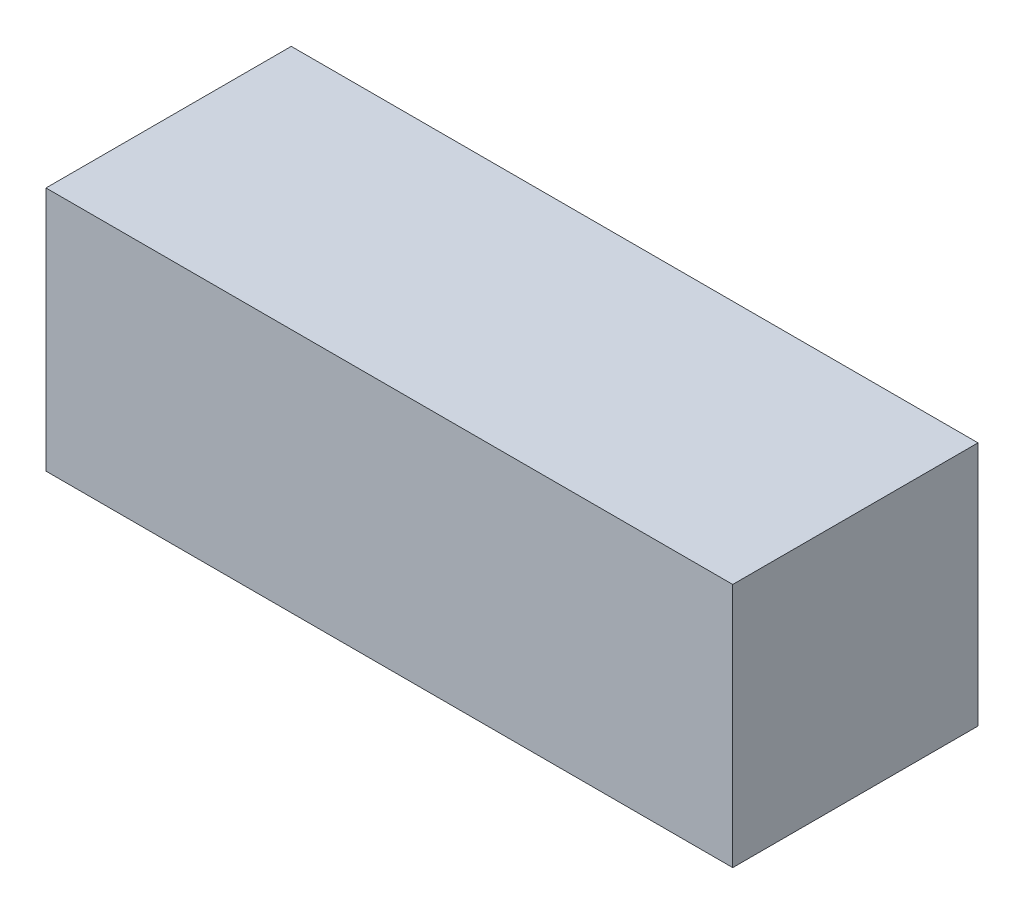
from build123d import *

# Parameters (mm, degrees)
SKETCH_2_W      = 140
SKETCH_2_H      = 50
EXTRUDE_1_DEPTH = 50


with BuildPart() as part:
    # Эскиз2 → Бобышка-Вытянуть1 (new body)
    with BuildSketch(Plane.XY):
        with Locations((70, 25)):
            Rectangle(SKETCH_2_W, SKETCH_2_H)
    extrude(amount=EXTRUDE_1_DEPTH)


solid = part.part
